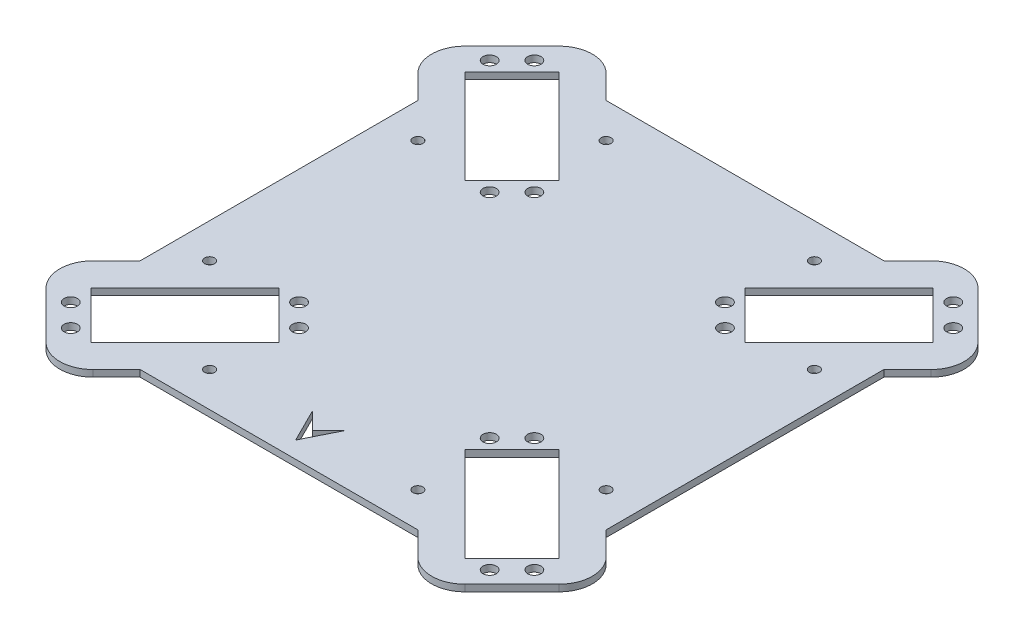
from build123d import *

# Parameters (mm, degrees)
SKETCH1_W           = 140
SKETCH1_H           = 140
BOSS_EXTRUDE1_DEPTH = 2
BOSS_EXTRUDE3_DEPTH = 2
SKETCH3_R           = 2
CUT_EXTRUDE1_DEPTH  = 2
FILLET1_R           = 10
SKETCH4_R           = 1.5
CUT_EXTRUDE2_DEPTH  = 2
CUT_EXTRUDE3_DEPTH  = 2


with BuildPart() as part:
    # Sketch1 → Boss-Extrude1 (new body)
    with BuildSketch(Plane(origin=(0, 0, 0), x_dir=(1, 0, 0), z_dir=(0, 1, 0))):
        with Locations((70, 70)):
            Rectangle(SKETCH1_W, SKETCH1_H)
    extrude(amount=BOSS_EXTRUDE1_DEPTH)

    # Sketch2 → Boss-Extrude3 (add)
    with BuildSketch(Plane(origin=(0, 2, 0), x_dir=(1, 0, 0), z_dir=(0, 1, 0))):
        Polygon((111.715728753, 140), (140, 111.715728753), (154.142135624, 125.857864376), (125.857864376, 154.142135624), align=None)
        Polygon((0, 111.715728753), (-14.142135624, 125.857864376), (14.142135624, 154.142135624), (28.284271247, 140), align=None)
        Polygon((28.284271247, 0), (0, 28.284271247), (-14.142135624, 14.142135624), (14.142135624, -14.142135624), align=None)
        Polygon((140, 28.284271247), (154.142135624, 14.142135624), (125.857864376, -14.142135624), (111.715728753, 0), align=None)
    extrude(amount=-BOSS_EXTRUDE3_DEPTH)

    # Sketch3 → Cut-Extrude1 (cut)
    with BuildSketch(Plane(origin=(0, 2, 0), x_dir=(1, 0, 0), z_dir=(0, 1, 0))):
        with Locations(Location((7.07813888, 0.360624458, 0), (0, 0, 270))):
            Circle(SKETCH3_R)
        with Locations(Location((0.360624458, 7.07813888, 0), (0, 0, 90))):
            Circle(SKETCH3_R)
        with Locations(Location((41.372817767, 34.655303346, 0), (0, 0, 90))):
            Circle(SKETCH3_R)
        with Locations(Location((34.655303346, 41.372817767, 0), (0, 0, 270))):
            Circle(SKETCH3_R)
        with Locations(Location((132.92186112, 0.360624458, 0), (0, 0, 90))):
            Circle(SKETCH3_R)
        with Locations(Location((139.639375542, 7.07813888, 0), (0, 0, 270))):
            Circle(SKETCH3_R)
        with Locations(Location((98.627182233, 34.655303346, 0), (0, 0, 270))):
            Circle(SKETCH3_R)
        with Locations(Location((105.344696654, 41.372817767, 0), (0, 0, 90))):
            Circle(SKETCH3_R)
        with Locations(Location((132.92186112, 139.639375542, 0), (0, 0, 270))):
            Circle(SKETCH3_R)
        with Locations(Location((139.639375542, 132.92186112, 0), (0, 0, 90))):
            Circle(SKETCH3_R)
        with Locations(Location((98.627182233, 105.344696654, 0), (0, 0, 90))):
            Circle(SKETCH3_R)
        with Locations(Location((105.344696654, 98.627182233, 0), (0, 0, 270))):
            Circle(SKETCH3_R)
        with Locations(Location((7.07813888, 139.639375542, 0), (0, 0, 90))):
            Circle(SKETCH3_R)
        with Locations(Location((0.360624458, 132.92186112, 0), (0, 0, 270))):
            Circle(SKETCH3_R)
        with Locations(Location((41.372817767, 105.344696654, 0), (0, 0, 270))):
            Circle(SKETCH3_R)
        with Locations(Location((34.655303346, 98.627182233, 0), (0, 0, 90))):
            Circle(SKETCH3_R)
        Polygon((13.795653301, -0.346482323), (42.079924548, 27.937788925), (27.937788925, 42.079924548), (-0.346482323, 13.795653301), align=None)
        Polygon((97.920075452, 27.937788925), (112.062211075, 42.079924548), (140.346482323, 13.795653301), (126.204346699, -0.346482323), align=None)
        Polygon((126.204346699, 140.346482323), (97.920075452, 112.062211075), (112.062211075, 97.920075452), (140.346482323, 126.204346699), align=None)
        Polygon((42.079924548, 112.062211075), (27.937788925, 97.920075452), (-0.346482323, 126.204346699), (13.795653301, 140.346482323), align=None)
    extrude(amount=-CUT_EXTRUDE1_DEPTH, mode=Mode.SUBTRACT)

    # Fillet1
    fillet1_edges = [part.edges().sort_by_distance(p)[0] for p in [
        (125.857864376, 1, -154.142135624),
        (154.142135624, 1, -125.857864376),
        (-14.142135624, 1, -125.857864376),
        (14.142135624, 1, -154.142135624),
        (14.142135624, 1, 14.142135624),
        (-14.142135624, 1, -14.142135624),
        (154.142135624, 1, -14.142135624),
        (125.857864376, 1, 14.142135624),
    ]]
    fillet(fillet1_edges, radius=FILLET1_R)

    # Sketch4 → Cut-Extrude2 (cut)
    with BuildSketch(Plane(origin=(0, 2, 0), x_dir=(1, 0, 0), z_dir=(0, 1, 0))):
        with Locations(Location((38.717631804, 10.433360556, 0), (0, 0, 270))):
            Circle(SKETCH4_R)
        with Locations(Location((10.433360556, 38.717631804, 0), (0, 0, 90))):
            Circle(SKETCH4_R)
        with Locations(Location((101.282368196, 10.433360556, 0), (0, 0, 90))):
            Circle(SKETCH4_R)
        with Locations(Location((129.566639444, 38.717631804, 0), (0, 0, 270))):
            Circle(SKETCH4_R)
        with Locations(Location((38.717631804, 129.566639444, 0), (0, 0, 90))):
            Circle(SKETCH4_R)
        with Locations(Location((10.433360556, 101.282368196, 0), (0, 0, 270))):
            Circle(SKETCH4_R)
        with Locations(Location((101.282368196, 129.566639444, 0), (0, 0, 270))):
            Circle(SKETCH4_R)
        with Locations(Location((129.566639444, 101.282368196, 0), (0, 0, 90))):
            Circle(SKETCH4_R)
    extrude(amount=-CUT_EXTRUDE2_DEPTH, mode=Mode.SUBTRACT)

    # Sketch5 → Cut-Extrude3 (cut)
    with BuildSketch(Plane(origin=(0, 2, 0), x_dir=(1, 0, 0), z_dir=(0, 1, 0))):
        Polygon((75, 15), (70, 10), (65, 15), (70, 5), align=None)
    extrude(amount=-CUT_EXTRUDE3_DEPTH, mode=Mode.SUBTRACT)


solid = part.part
